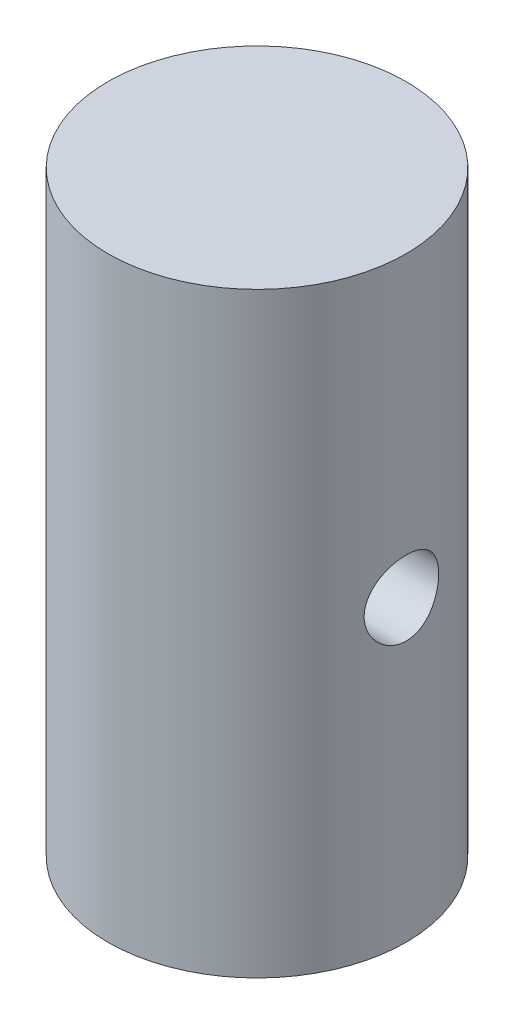
from build123d import *

# Parameters (mm, degrees)
SKETCH_1_R          = 10
EXTRUDE_1_DEPTH     = 40
SKETCH_2_R          = 2.5
CUT_EXTRUDE_1_DEPTH = 20


with BuildPart() as part:
    # 草图1 → 凸台-拉伸1 (new body)
    with BuildSketch(Plane(origin=(0, 0, 0), x_dir=(1, 0, 0), z_dir=(0, 1, 0))):
        with Locations(Location((0, 0, 0), (0, 0, 270))):
            Circle(SKETCH_1_R)
    extrude(amount=EXTRUDE_1_DEPTH)

    # 草图2 → 切除-拉伸1 (cut, symmetric)
    with BuildSketch(Plane(origin=(0, 0, 0), x_dir=(0, 0, -1), z_dir=(1, 0, 0))):
        with Locations((0, 20)):
            Circle(SKETCH_2_R)
    extrude(amount=CUT_EXTRUDE_1_DEPTH, both=True, mode=Mode.SUBTRACT)


solid = part.part
